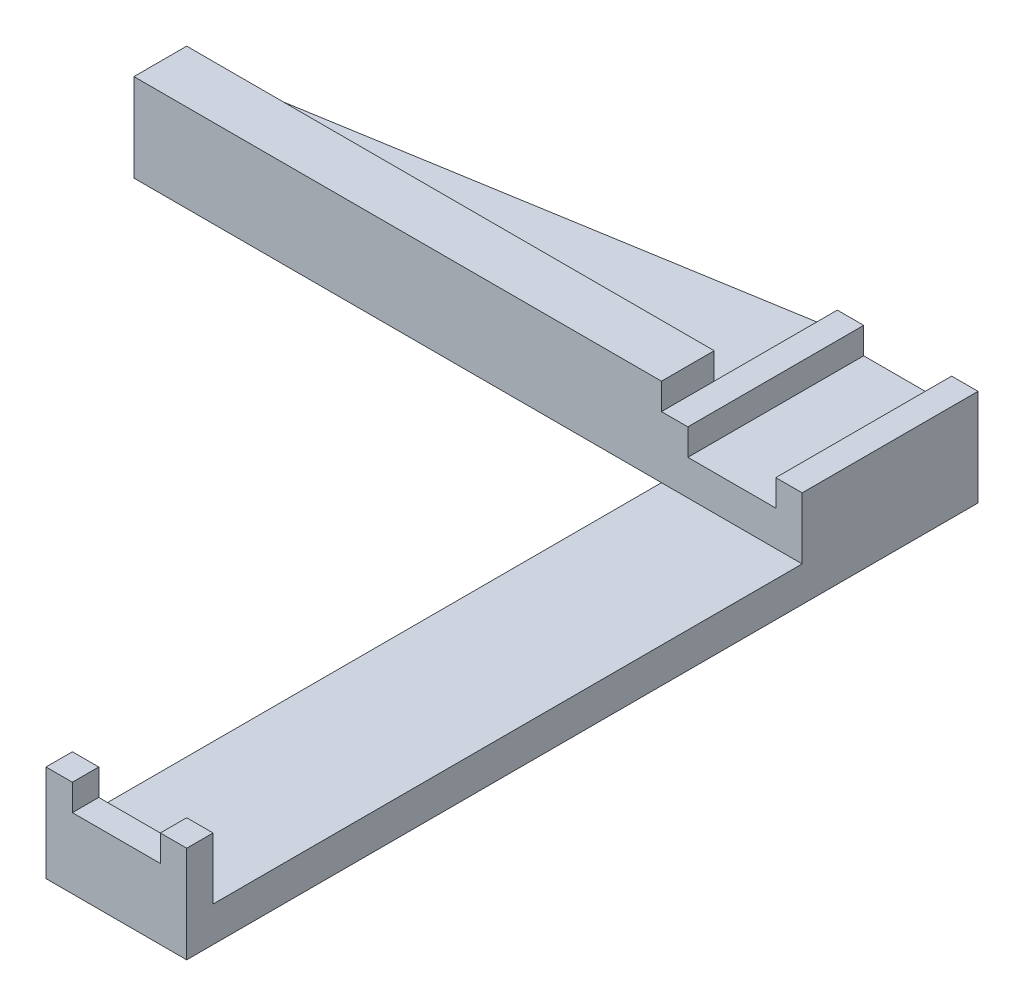
from build123d import *

# Parameters (mm, degrees)
BOSS_EXTRUDE1_DEPTH = 12
SKETCH2_W           = 8
SKETCH2_H           = 33.5
CUT_EXTRUDE1_DEPTH  = 10
SKETCH3_W           = 8
SKETCH3_H           = 45
CUT_EXTRUDE2_DEPTH  = 6.5
SKETCH4_W           = 5
SKETCH4_H           = 10
CUT_EXTRUDE3_DEPTH  = 1.5
SKETCH5_W           = 5
SKETCH5_H           = 1.5
CUT_EXTRUDE4_DEPTH  = 1.5
CUT_EXTRUDE5_DEPTH  = 2
CUT_EXTRUDE7_DEPTH  = 1
CUT_EXTRUDE8_DEPTH  = 4
SKETCH10_W          = 30
SKETCH10_H          = 3
CUT_EXTRUDE9_DEPTH  = 4
CUT_EXTRUDE10_DEPTH = 2.5


with BuildPart() as part:
    # Sketch1 → Boss-Extrude1 (new body)
    with BuildSketch(Plane(origin=(0, 0, 0), x_dir=(1, 0, 0), z_dir=(0, 1, 0))):
        Polygon((0, 0), (30, 0), (30, -35), (38, -35), (38, 10), (30, 10), (0, 5), align=None)
    extrude(amount=BOSS_EXTRUDE1_DEPTH)

    # Sketch2 → Cut-Extrude1 (cut)
    with BuildSketch(Plane(origin=(0, 12, 0), x_dir=(1, 0, 0), z_dir=(0, 1, 0))):
        with Locations((34, -16.75)):
            Rectangle(SKETCH2_W, SKETCH2_H)
    extrude(amount=-CUT_EXTRUDE1_DEPTH, mode=Mode.SUBTRACT)

    # Sketch3 → Cut-Extrude2 (cut)
    with BuildSketch(Plane(origin=(0, 12, 0), x_dir=(1, 0, 0), z_dir=(0, 1, 0))):
        with Locations((34, -12.5)):
            Rectangle(SKETCH3_W, SKETCH3_H)
    extrude(amount=-CUT_EXTRUDE2_DEPTH, mode=Mode.SUBTRACT)

    # Sketch4 → Cut-Extrude3 (cut)
    with BuildSketch(Plane(origin=(0, 5.5, 0), x_dir=(1, 0, 0), z_dir=(0, 1, 0))):
        with Locations((34, 5)):
            Rectangle(SKETCH4_W, SKETCH4_H)
    extrude(amount=-CUT_EXTRUDE3_DEPTH, mode=Mode.SUBTRACT)

    # Sketch5 → Cut-Extrude4 (cut)
    with BuildSketch(Plane(origin=(0, 5.5, 0), x_dir=(1, 0, 0), z_dir=(0, 1, 0))):
        with Locations((34, -34.25)):
            Rectangle(SKETCH5_W, SKETCH5_H)
    extrude(amount=-CUT_EXTRUDE4_DEPTH, mode=Mode.SUBTRACT)

    # Sketch6 → Cut-Extrude5 (cut)
    with BuildSketch(Plane.XZ):
        Polygon((0, 0), (30, 0), (30, -10), (0, -5), align=None)
    extrude(amount=-CUT_EXTRUDE5_DEPTH, mode=Mode.SUBTRACT)

    # Sketch7 → Cut-Extrude7 (cut)
    with BuildSketch(Plane(origin=(0, 12, 0), x_dir=(1, 0, 0), z_dir=(0, 1, 0))):
        Polygon((0, 5), (30, 10), (30, 0), (0, 0), align=None)
    extrude(amount=-CUT_EXTRUDE7_DEPTH, mode=Mode.SUBTRACT)

    # Sketch9 → Cut-Extrude8 (cut)
    with BuildSketch(Plane(origin=(0, 11, 0), x_dir=(1, 0, 0), z_dir=(0, 1, 0))):
        Polygon((0, 5), (30, 10), (30, 3), (0, 3), align=None)
    extrude(amount=-CUT_EXTRUDE8_DEPTH, mode=Mode.SUBTRACT)

    # Sketch10 → Cut-Extrude9 (cut)
    with BuildSketch(Plane(origin=(0, 11, 0), x_dir=(1, 0, 0), z_dir=(0, 1, 0))):
        with Locations((15, 1.5)):
            Rectangle(SKETCH10_W, SKETCH10_H)
    extrude(amount=-CUT_EXTRUDE9_DEPTH, mode=Mode.SUBTRACT)

    # Sketch11 → Cut-Extrude10 (cut)
    with BuildSketch(Plane(origin=(0, 7, 0), x_dir=(1, 0, 0), z_dir=(0, 1, 0))):
        Polygon((0, 5), (30, 10), (30, 3), (0, 3), align=None)
    extrude(amount=-CUT_EXTRUDE10_DEPTH, mode=Mode.SUBTRACT)


solid = part.part
